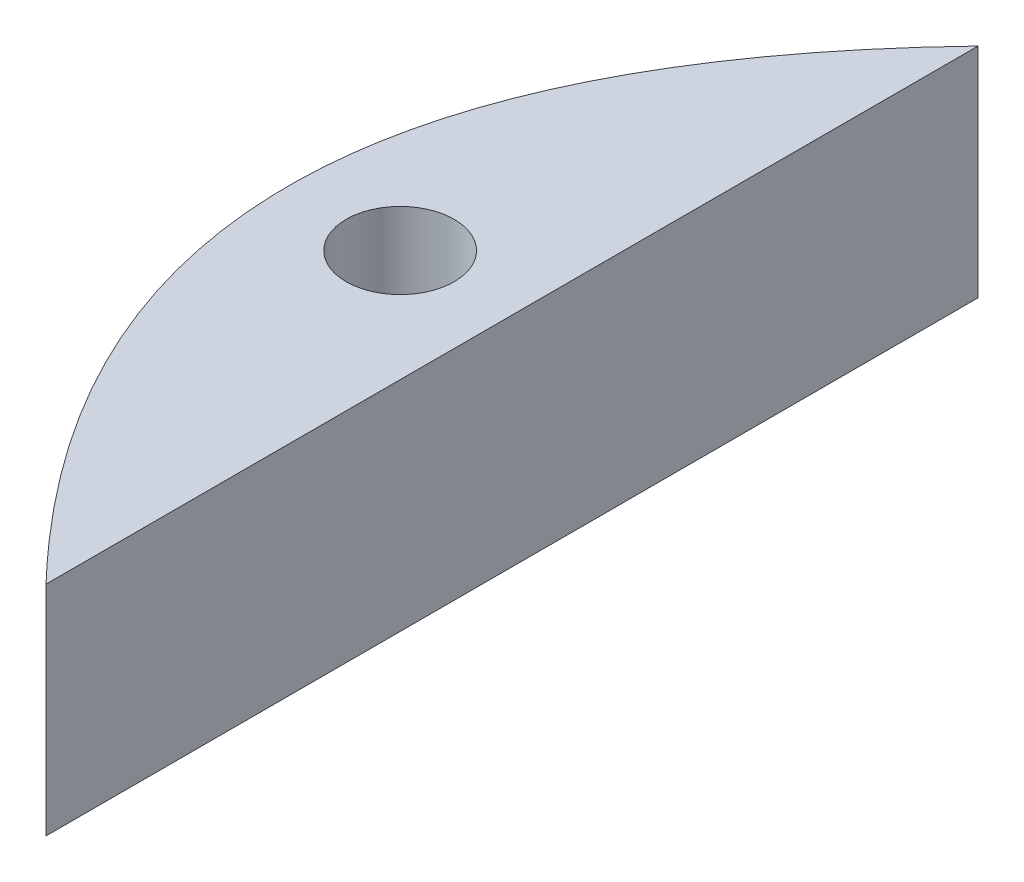
from build123d import *

# Parameters (mm, degrees)
SKETCH1_R           = 1.45
BOSS_EXTRUDE1_DEPTH = 5.85


with BuildPart() as part:
    # Sketch1 → Boss-Extrude1 (new body)
    with BuildSketch(Plane(origin=(0, 0, 0), x_dir=(1, 0, 0), z_dir=(0, 1, 0))):
        with BuildLine():
            Line((3, 12.5), (3, -12.5))
            add(Edge.make_bspline(
                [(3, 12.5), (-9, 0), (3, -12.5)],
                knots=[0, 0, 0, 1, 1, 1], degree=2))
        make_face()
        with Locations(Location((0, 0, 0), (0, 0, 270))):
            Circle(SKETCH1_R, mode=Mode.SUBTRACT)
    extrude(amount=BOSS_EXTRUDE1_DEPTH)


solid = part.part
